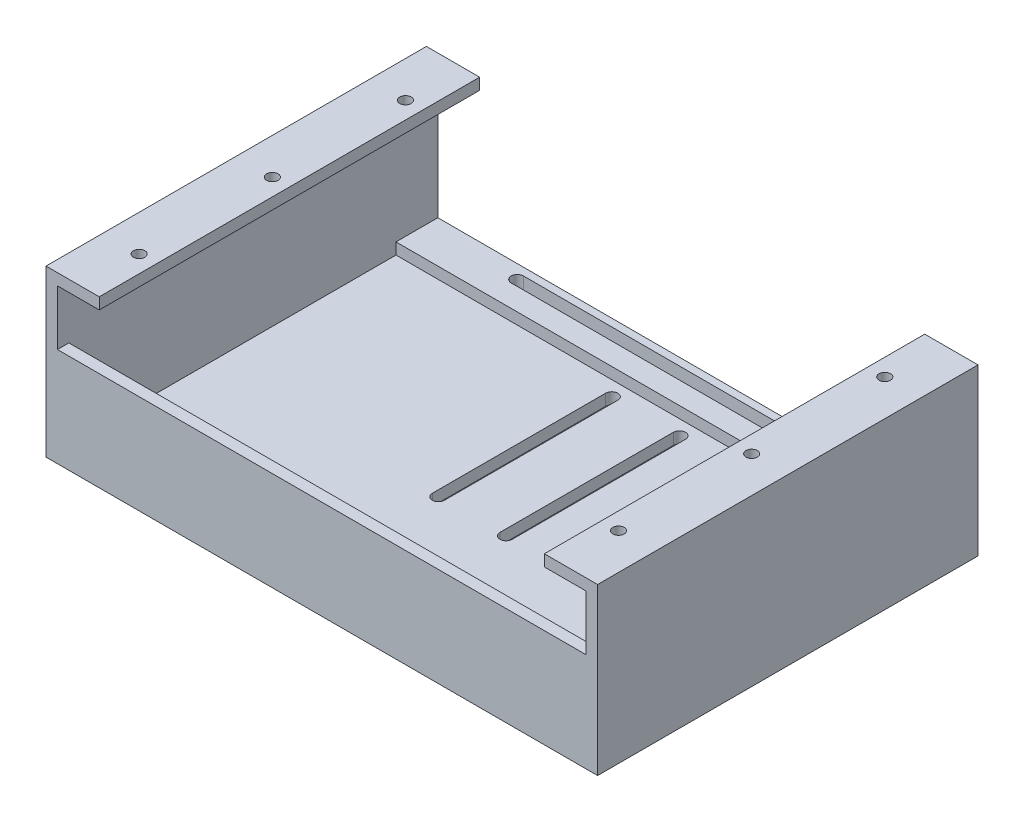
from build123d import *

# Parameters (mm, degrees)
SKETCH_1_W          = 145
SKETCH_1_H          = 100
EXTRUDE_1_DEPTH     = 3
EXTRUDE_START       = 3
SKETCH_2_W          = 3
SKETCH_2_H          = 100
EXTRUDE_2_DEPTH     = 40.5
SKETCH_3_W          = 139
SKETCH_3_H          = 3
EXTRUDE_3_DEPTH     = 23
SKETCH_4_W          = 14
SKETCH_4_H          = 100
EXTRUDE_4_DEPTH     = 3
CUT_EXTRUDE_1_REACH = 100.227
SKETCH_5_R          = 1.5
CUT_EXTRUDE_2_REACH = 100.227
EXTRUDE_5_REACH     = 158.704
SKETCH_7_W          = 11
SKETCH_7_H          = 3
CUT_EXTRUDE_3_REACH = 97.721


with BuildPart() as part:
    # 草图1 → 凸台-拉伸1 (new body)
    with BuildSketch(Plane(origin=(0, 0, 0), x_dir=(1, 0, 0), z_dir=(0, 1, 0))):
        Rectangle(SKETCH_1_W, SKETCH_1_H)
    extrude(amount=EXTRUDE_1_DEPTH)

    # 草图2 → 凸台-拉伸2 (add)
    with BuildSketch(Plane(origin=(0, 0, 0), x_dir=(1, 0, 0), z_dir=(0, 1, 0)).offset(EXTRUDE_START)):
        with Locations((-71, 0)):
            Rectangle(SKETCH_2_W, SKETCH_2_H)
        with Locations((71, 0)):
            Rectangle(SKETCH_2_W, SKETCH_2_H)
    extrude(amount=EXTRUDE_2_DEPTH)

    # 草图3 → 凸台-拉伸3 (add)
    with BuildSketch(Plane(origin=(0, 3, 0), x_dir=(1, 0, 0), z_dir=(0, 1, 0))):
        with Locations((0, -48.5)):
            Rectangle(SKETCH_3_W, SKETCH_3_H)
    extrude(amount=EXTRUDE_3_DEPTH)

    # 草图4 → 凸台-拉伸4 (add)
    with BuildSketch(Plane(origin=(0, 43.5, 0), x_dir=(1, 0, 0), z_dir=(0, 1, 0))):
        with Locations((-65.5, 0)):
            Rectangle(SKETCH_4_W, SKETCH_4_H)
        with Locations((65.5, 0)):
            Rectangle(SKETCH_4_W, SKETCH_4_H)
    extrude(amount=-EXTRUDE_4_DEPTH)

    # 草图5 → 切除-拉伸1 (cut, up to next)
    with BuildSketch(Plane(origin=(0, 43.5, 0), x_dir=(1, 0, 0), z_dir=(0, 1, 0)), mode=Mode.PRIVATE) as cut_extrude_1_sk1:
        with Locations(Location((-63, 35, 0), (0, 0, 270))):
            Circle(SKETCH_5_R)
    cut_extrude_1_tool1 = extrude(cut_extrude_1_sk1.sketch, amount=-CUT_EXTRUDE_1_REACH, mode=Mode.PRIVATE) & part.part
    # 草图5 → 切除-拉伸1 (cut, up to next)
    with BuildSketch(Plane(origin=(0, 43.5, 0), x_dir=(1, 0, 0), z_dir=(0, 1, 0)), mode=Mode.PRIVATE) as cut_extrude_1_sk2:
        with Locations(Location((-63, 0, 0), (0, 0, 270))):
            Circle(SKETCH_5_R)
    cut_extrude_1_tool2 = extrude(cut_extrude_1_sk2.sketch, amount=-CUT_EXTRUDE_1_REACH, mode=Mode.PRIVATE) & part.part
    # 草图5 → 切除-拉伸1 (cut, up to next)
    with BuildSketch(Plane(origin=(0, 43.5, 0), x_dir=(1, 0, 0), z_dir=(0, 1, 0)), mode=Mode.PRIVATE) as cut_extrude_1_sk3:
        with Locations(Location((-63, -35, 0), (0, 0, 270))):
            Circle(SKETCH_5_R)
    cut_extrude_1_tool3 = extrude(cut_extrude_1_sk3.sketch, amount=-CUT_EXTRUDE_1_REACH, mode=Mode.PRIVATE) & part.part
    # 草图5 → 切除-拉伸1 (cut, up to next)
    with BuildSketch(Plane(origin=(0, 43.5, 0), x_dir=(1, 0, 0), z_dir=(0, 1, 0)), mode=Mode.PRIVATE) as cut_extrude_1_sk4:
        with Locations(Location((63, -35, 0), (0, 0, 270))):
            Circle(SKETCH_5_R)
    cut_extrude_1_tool4 = extrude(cut_extrude_1_sk4.sketch, amount=-CUT_EXTRUDE_1_REACH, mode=Mode.PRIVATE) & part.part
    # 草图5 → 切除-拉伸1 (cut, up to next)
    with BuildSketch(Plane(origin=(0, 43.5, 0), x_dir=(1, 0, 0), z_dir=(0, 1, 0)), mode=Mode.PRIVATE) as cut_extrude_1_sk5:
        with Locations(Location((63, 0, 0), (0, 0, 270))):
            Circle(SKETCH_5_R)
    cut_extrude_1_tool5 = extrude(cut_extrude_1_sk5.sketch, amount=-CUT_EXTRUDE_1_REACH, mode=Mode.PRIVATE) & part.part
    # 草图5 → 切除-拉伸1 (cut, up to next)
    with BuildSketch(Plane(origin=(0, 43.5, 0), x_dir=(1, 0, 0), z_dir=(0, 1, 0)), mode=Mode.PRIVATE) as cut_extrude_1_sk6:
        with Locations(Location((63, 35, 0), (0, 0, 270))):
            Circle(SKETCH_5_R)
    cut_extrude_1_tool6 = extrude(cut_extrude_1_sk6.sketch, amount=-CUT_EXTRUDE_1_REACH, mode=Mode.PRIVATE) & part.part
    add(cut_extrude_1_tool1.solids().sort_by_distance((-63, 43.5, -35))[0], mode=Mode.SUBTRACT)
    add(cut_extrude_1_tool2.solids().sort_by_distance((-63, 43.5, 0))[0], mode=Mode.SUBTRACT)
    add(cut_extrude_1_tool3.solids().sort_by_distance((-63, 43.5, 35))[0], mode=Mode.SUBTRACT)
    add(cut_extrude_1_tool4.solids().sort_by_distance((63, 43.5, 35))[0], mode=Mode.SUBTRACT)
    add(cut_extrude_1_tool5.solids().sort_by_distance((63, 43.5, 0))[0], mode=Mode.SUBTRACT)
    add(cut_extrude_1_tool6.solids().sort_by_distance((63, 43.5, -35))[0], mode=Mode.SUBTRACT)

    # 草图6 → 切除-拉伸2 (cut, up to next)
    with BuildSketch(Plane.XZ, mode=Mode.PRIVATE) as cut_extrude_2_sk1:
        with BuildLine():
            Line((-7.3, 10.448254834), (-7.3, -35.117406069))
            ThreePointArc((-7.3, -35.117406069), (-8.9, -36.717406069), (-10.5, -35.117406069))
            Line((-10.5, -35.117406069), (-10.5, 10.448254834))
            ThreePointArc((-10.5, 10.448254834), (-8.9, 12.048254834), (-7.3, 10.448254834))
        make_face()
    cut_extrude_2_tool1 = extrude(cut_extrude_2_sk1.sketch, amount=-CUT_EXTRUDE_2_REACH, mode=Mode.PRIVATE) & part.part
    # 草图6 → 切除-拉伸2 (cut, up to next)
    with BuildSketch(Plane.XZ, mode=Mode.PRIVATE) as cut_extrude_2_sk2:
        with BuildLine():
            Line((7.3, 10.448254834), (7.3, -35.117406069))
            ThreePointArc((7.3, -35.117406069), (8.9, -36.717406069), (10.5, -35.117406069))
            Line((10.5, -35.117406069), (10.5, 10.448254834))
            ThreePointArc((10.5, 10.448254834), (8.9, 12.048254834), (7.3, 10.448254834))
        make_face()
    cut_extrude_2_tool2 = extrude(cut_extrude_2_sk2.sketch, amount=-CUT_EXTRUDE_2_REACH, mode=Mode.PRIVATE) & part.part
    add(cut_extrude_2_tool1.solids().sort_by_distance((-8.9, 0, -12.334576))[0], mode=Mode.SUBTRACT)
    add(cut_extrude_2_tool2.solids().sort_by_distance((8.9, 0, -12.334576))[0], mode=Mode.SUBTRACT)

    # 草图7 → 凸台-拉伸5 (add, up to next)
    with BuildSketch(Plane.ZY.offset(-69.5), mode=Mode.PRIVATE) as extrude_5_sk1:
        with Locations((-44.5, 4.5)):
            Rectangle(SKETCH_7_W, SKETCH_7_H)
    extrude_5_tool1 = extrude(extrude_5_sk1.sketch, amount=EXTRUDE_5_REACH, mode=Mode.PRIVATE) - part.part
    add(extrude_5_tool1.solids().sort_by_distance((69.5, 4.5, -44.5))[0])

    # 草图8 → 切除-拉伸3 (cut, up to next)
    with BuildSketch(Plane(origin=(0, 6, 0), x_dir=(1, 0, 0), z_dir=(0, 1, 0)), mode=Mode.PRIVATE) as cut_extrude_3_sk1:
        with BuildLine():
            Line((-45, 48), (45, 48))
            ThreePointArc((45, 48), (46.6, 46.4), (45, 44.8))
            Line((45, 44.8), (-45, 44.8))
            ThreePointArc((-45, 44.8), (-46.6, 46.4), (-45, 48))
        make_face()
    cut_extrude_3_tool1 = extrude(cut_extrude_3_sk1.sketch, amount=-CUT_EXTRUDE_3_REACH, mode=Mode.PRIVATE) & part.part
    add(cut_extrude_3_tool1.solids().sort_by_distance((0, 6, -46.4))[0], mode=Mode.SUBTRACT)


solid = part.part
